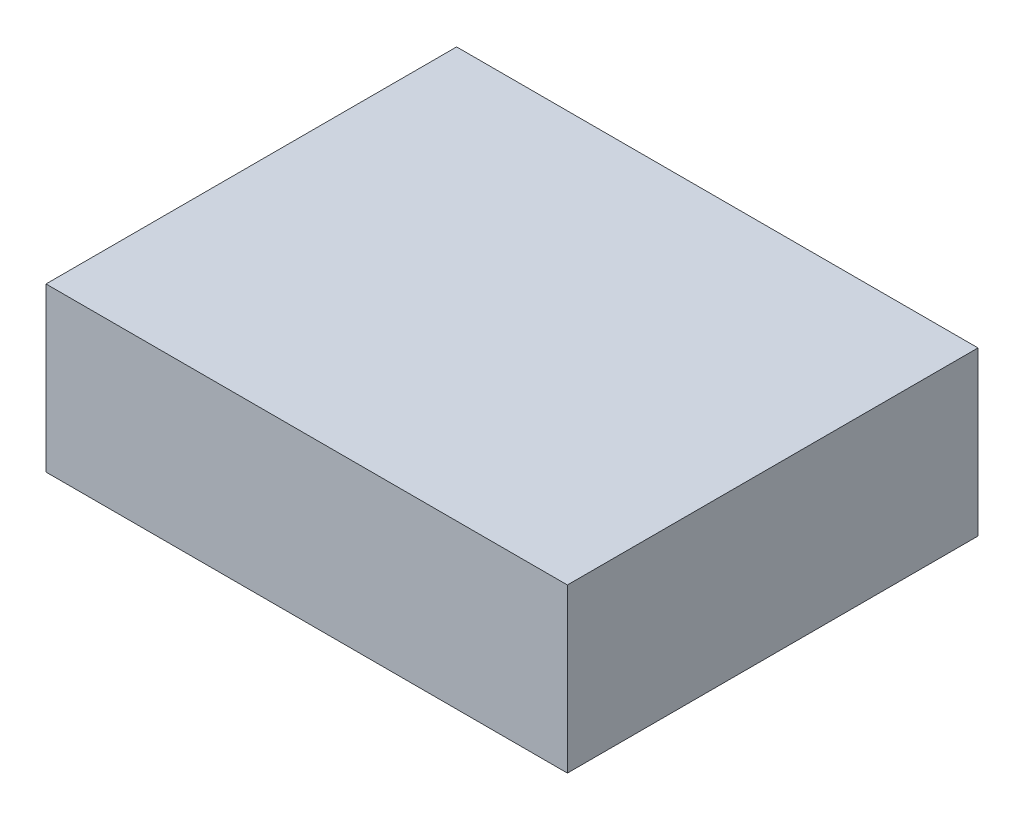
from build123d import *

# Parameters (mm, degrees)
SKETCH_2_W      = 80
SKETCH_2_H      = 63
EXTRUDE_1_DEPTH = 25


with BuildPart() as part:
    # 草图2 → 凸台-拉伸1 (new body)
    with BuildSketch(Plane(origin=(0, 0, 0), x_dir=(1, 0, 0), z_dir=(0, 1, 0))):
        with Locations((40, 31.5)):
            Rectangle(SKETCH_2_W, SKETCH_2_H)
    extrude(amount=EXTRUDE_1_DEPTH)


solid = part.part
